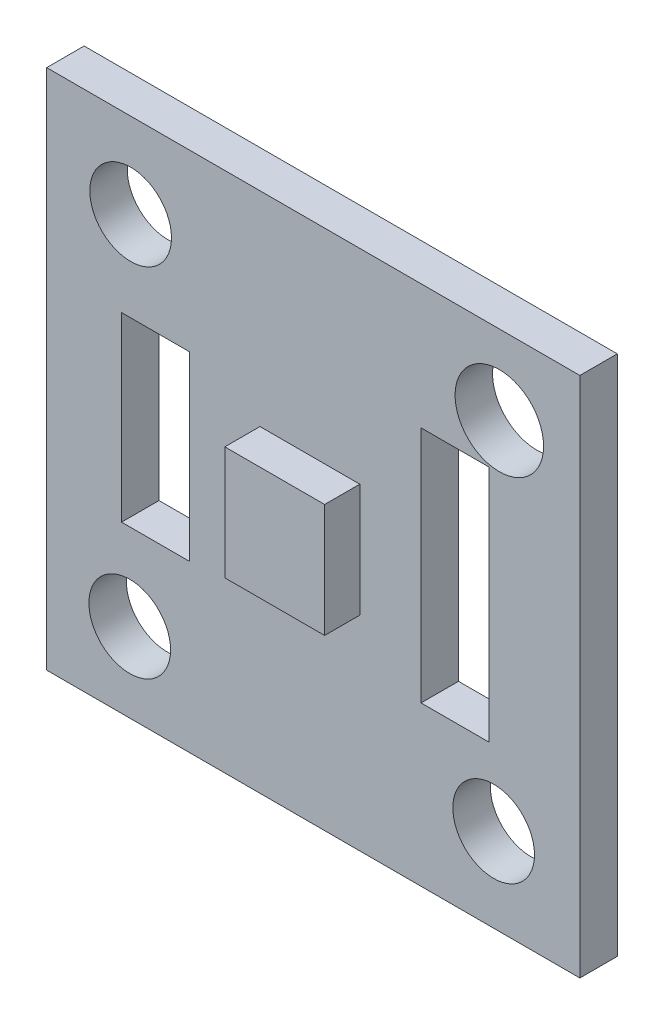
from build123d import *

# Parameters (mm, degrees)
SKETCH1_W           = 23.5
SKETCH1_H           = 23
BOSS_EXTRUDE1_DEPTH = 1.65
SKETCH2_W           = 4.4
SKETCH2_H           = 5
BOSS_EXTRUDE2_DEPTH = 1.55
CUT_EXTRUDE1_REACH  = 34.924
SKETCH3_W           = 3
SKETCH3_H           = 10.5
CUT_EXTRUDE2_REACH  = 34.924
SKETCH4_W           = 3
SKETCH4_H           = 8
CUT_EXTRUDE3_REACH  = 34.924
SKETCH5_R           = 1.8
SKETCH5_R_2         = 1.95


with BuildPart() as part:
    # Sketch1 → Boss-Extrude1 (new body)
    with BuildSketch(Plane.XY):
        with Locations((11.75, 11.5)):
            Rectangle(SKETCH1_W, SKETCH1_H)
    extrude(amount=BOSS_EXTRUDE1_DEPTH)

    # Sketch2 → Boss-Extrude2 (add)
    with BuildSketch(Plane.XY.offset(1.65)):
        with Locations((11.6, 11.5)):
            Rectangle(SKETCH2_W, SKETCH2_H)
    extrude(amount=BOSS_EXTRUDE2_DEPTH)

    # Sketch3 → Cut-Extrude1 (cut, up to next)
    with BuildSketch(Plane.XY.offset(1.65), mode=Mode.PRIVATE) as cut_extrude1_sk1:
        with Locations((18, 12.25)):
            Rectangle(SKETCH3_W, SKETCH3_H)
    cut_extrude1_tool1 = extrude(cut_extrude1_sk1.sketch, amount=-CUT_EXTRUDE1_REACH, mode=Mode.PRIVATE) & part.part
    add(cut_extrude1_tool1.solids().sort_by_distance((18, 12.25, 1.65))[0], mode=Mode.SUBTRACT)

    # Sketch4 → Cut-Extrude2 (cut, up to next)
    with BuildSketch(Plane.XY.offset(1.65), mode=Mode.PRIVATE) as cut_extrude2_sk1:
        with Locations((4.8, 11.3)):
            Rectangle(SKETCH4_W, SKETCH4_H)
    cut_extrude2_tool1 = extrude(cut_extrude2_sk1.sketch, amount=-CUT_EXTRUDE2_REACH, mode=Mode.PRIVATE) & part.part
    add(cut_extrude2_tool1.solids().sort_by_distance((4.8, 11.3, 1.65))[0], mode=Mode.SUBTRACT)

    # Sketch5 → Cut-Extrude3 (cut, up to next)
    with BuildSketch(Plane.XY.offset(1.65), mode=Mode.PRIVATE) as cut_extrude3_sk1:
        with Locations((3.7, 19.25)):
            Circle(SKETCH5_R)
    cut_extrude3_tool1 = extrude(cut_extrude3_sk1.sketch, amount=-CUT_EXTRUDE3_REACH, mode=Mode.PRIVATE) & part.part
    # Sketch5 → Cut-Extrude3 (cut, up to next)
    with BuildSketch(Plane.XY.offset(1.65), mode=Mode.PRIVATE) as cut_extrude3_sk2:
        with Locations((19.95, 19.5)):
            Circle(SKETCH5_R_2)
    cut_extrude3_tool2 = extrude(cut_extrude3_sk2.sketch, amount=-CUT_EXTRUDE3_REACH, mode=Mode.PRIVATE) & part.part
    # Sketch5 → Cut-Extrude3 (cut, up to next)
    with BuildSketch(Plane.XY.offset(1.65), mode=Mode.PRIVATE) as cut_extrude3_sk3:
        with Locations((19.7, 3.7)):
            Circle(SKETCH5_R)
    cut_extrude3_tool3 = extrude(cut_extrude3_sk3.sketch, amount=-CUT_EXTRUDE3_REACH, mode=Mode.PRIVATE) & part.part
    # Sketch5 → Cut-Extrude3 (cut, up to next)
    with BuildSketch(Plane.XY.offset(1.65), mode=Mode.PRIVATE) as cut_extrude3_sk4:
        with Locations((3.66, 3.5)):
            Circle(SKETCH5_R)
    cut_extrude3_tool4 = extrude(cut_extrude3_sk4.sketch, amount=-CUT_EXTRUDE3_REACH, mode=Mode.PRIVATE) & part.part
    add(cut_extrude3_tool1.solids().sort_by_distance((3.7, 19.25, 1.65))[0], mode=Mode.SUBTRACT)
    add(cut_extrude3_tool2.solids().sort_by_distance((19.95, 19.5, 1.65))[0], mode=Mode.SUBTRACT)
    add(cut_extrude3_tool3.solids().sort_by_distance((19.7, 3.7, 1.65))[0], mode=Mode.SUBTRACT)
    add(cut_extrude3_tool4.solids().sort_by_distance((3.66, 3.5, 1.65))[0], mode=Mode.SUBTRACT)


solid = part.part
